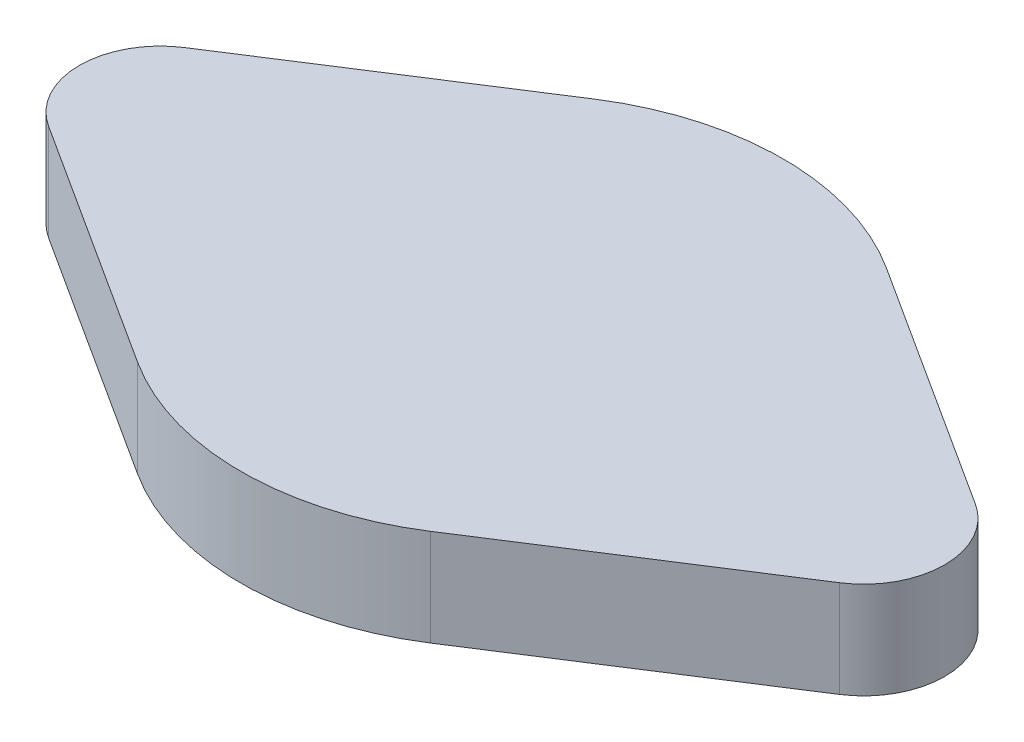
from build123d import *

# Parameters (mm, degrees)
BOSS_EXTRUDE1_DEPTH = 5


with BuildPart() as part:
    # Sketch1 → Boss-Extrude1 (new body)
    with BuildSketch(Plane(origin=(0, 0, 0), x_dir=(1, 0, 0), z_dir=(0, 1, 0))):
        with BuildLine():
            Line((-20.432418055, 3.512858569), (-7.567581945, 11.778442321))
            ThreePointArc((-7.567581945, 11.778442321), (0, 14), (7.567581945, 11.778442321))
            Line((7.567581945, 11.778442321), (20.432418055, 3.512858569))
            ThreePointArc((20.432418055, 3.512858569), (22.350852961, 0), (20.432418055, -3.512858569))
            Line((20.432418055, -3.512858569), (7.567581945, -11.778442321))
            ThreePointArc((7.567581945, -11.778442321), (0, -14), (-7.567581945, -11.778442321))
            Line((-7.567581945, -11.778442321), (-20.432418055, -3.512858569))
            ThreePointArc((-20.432418055, -3.512858569), (-22.350852961, 0), (-20.432418055, 3.512858569))
        make_face()
    extrude(amount=BOSS_EXTRUDE1_DEPTH)


solid = part.part
